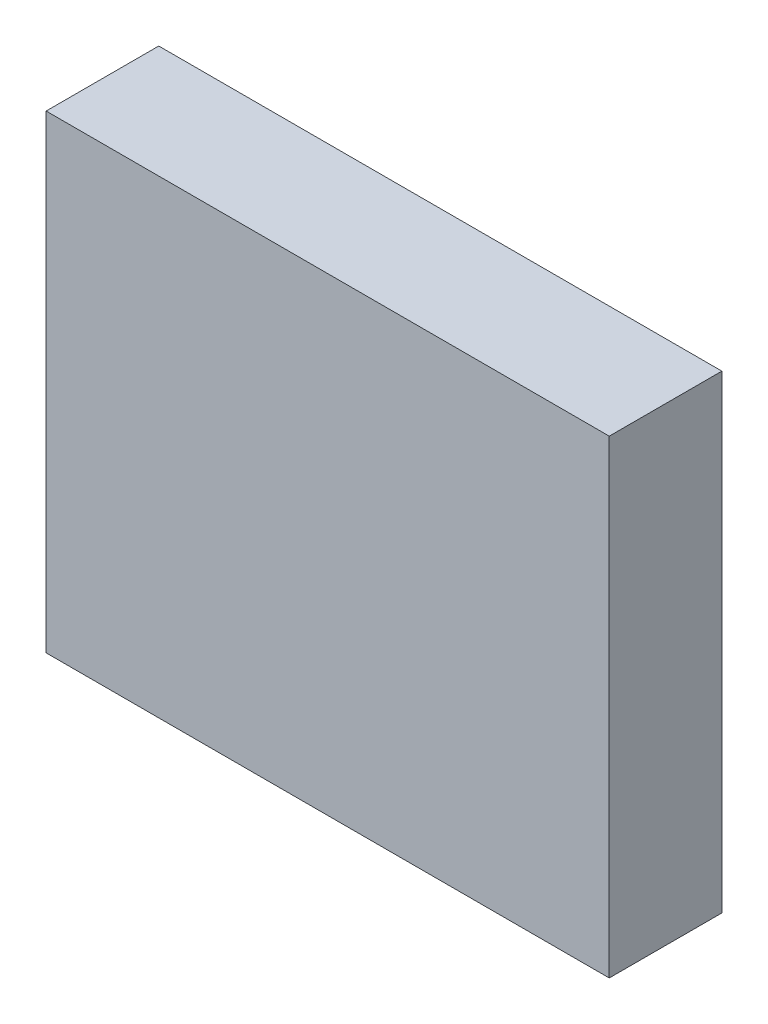
from build123d import *

# Parameters (mm, degrees)
STORE_SOG1_KONDENSER_1_START = -240
SKETCH1_W                    = 300
SKETCH1_H                    = 250
STORE_SOG1_KONDENSER_1_DEPTH = 60


with BuildPart() as part:
    # Sketch1 → STORE_sog1_kondenser_1 (new body)
    with BuildSketch(Plane.XY.offset(STORE_SOG1_KONDENSER_1_START)):
        with Locations((450, 1805)):
            Rectangle(SKETCH1_W, SKETCH1_H)
    extrude(amount=-STORE_SOG1_KONDENSER_1_DEPTH)


solid = part.part
